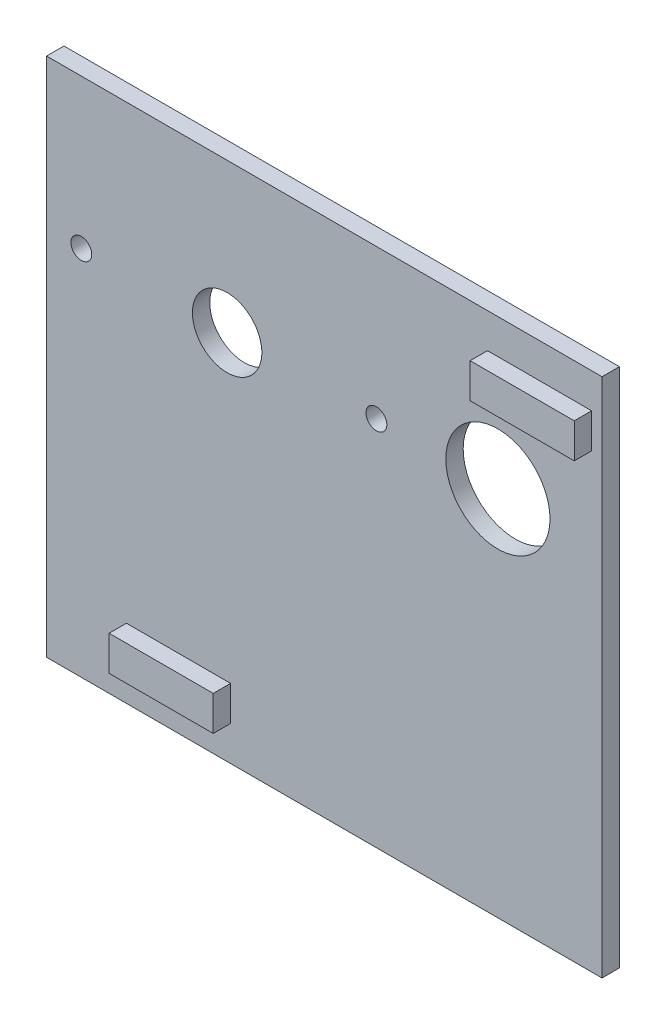
from build123d import *

# Parameters (mm, degrees)
SKETCH1_W           = 160
SKETCH1_H           = 150
BOSS_EXTRUDE1_DEPTH = 5
SKETCH2_W           = 30
SKETCH2_H           = 10
BOSS_EXTRUDE2_DEPTH = 5
SKETCH4_R           = 3
SKETCH4_R_2         = 10
SKETCH4_R_3         = 15
CUT_EXTRUDE1_DEPTH  = 15


with BuildPart() as part:
    # Sketch1 → Boss-Extrude1 (new body)
    with BuildSketch(Plane.XY):
        with Locations((-80, -75)):
            Rectangle(SKETCH1_W, SKETCH1_H)
    extrude(amount=BOSS_EXTRUDE1_DEPTH)

    # Sketch2 → Boss-Extrude2 (add)
    with BuildSketch(Plane.XY.offset(5)):
        with Locations((-18, -15)):
            Rectangle(SKETCH2_W, SKETCH2_H)
        with Locations((-122, -135)):
            Rectangle(SKETCH2_W, SKETCH2_H)
    extrude(amount=BOSS_EXTRUDE2_DEPTH)

    # Sketch4 → Cut-Extrude1 (cut)
    with BuildSketch(Plane.XY.offset(10)):
        with Locations(Location((-150, -43, 0), (0, 0, 180))):
            Circle(SKETCH4_R)
        with Locations(Location((-108, -43, 0), (0, 0, 180))):
            Circle(SKETCH4_R_2)
        with Locations(Location((-65, -43, 0), (0, 0, 180))):
            Circle(SKETCH4_R)
        with Locations(Location((-30, -43, 0), (0, 0, 180))):
            Circle(SKETCH4_R_3)
    extrude(amount=-CUT_EXTRUDE1_DEPTH, mode=Mode.SUBTRACT)


solid = part.part
